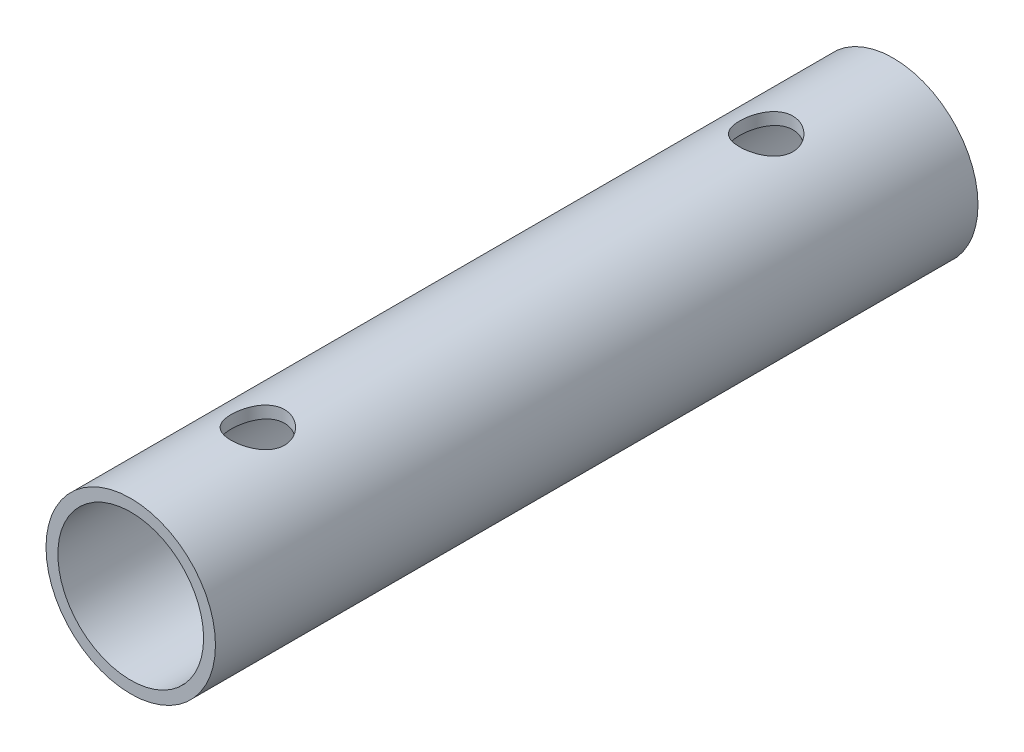
from build123d import *

# Parameters (mm, degrees)
SKETCH1_R               = 6.35
SKETCH1_R_2             = 5.461
EXTRUDE1_DEPTH          = 57.15
CUT_EXTRUDE1_DEPTH      = 38.1
CUT_EXTRUDE1_DEPTH_BACK = 38.1
SKETCH2_R               = 2


with BuildPart() as part:
    # Sketch1 → Extrude1 (new body)
    with BuildSketch(Plane.XY):
        Circle(SKETCH1_R)
        Circle(SKETCH1_R_2, mode=Mode.SUBTRACT)
    extrude(amount=EXTRUDE1_DEPTH)

    # Sketch2 → Cut-Extrude1 (cut, two sides: drawn at the far end of the back side and taken through both)
    with BuildSketch(Plane(origin=(0, 0, 0), x_dir=(1, 0, 0), z_dir=(0, 1, 0)).offset(-CUT_EXTRUDE1_DEPTH_BACK)):
        with Locations((0, -9.525)):
            Circle(SKETCH2_R)
        with Locations((0, -47.625)):
            Circle(SKETCH2_R)
    extrude(amount=CUT_EXTRUDE1_DEPTH + CUT_EXTRUDE1_DEPTH_BACK, mode=Mode.SUBTRACT)


solid = part.part
